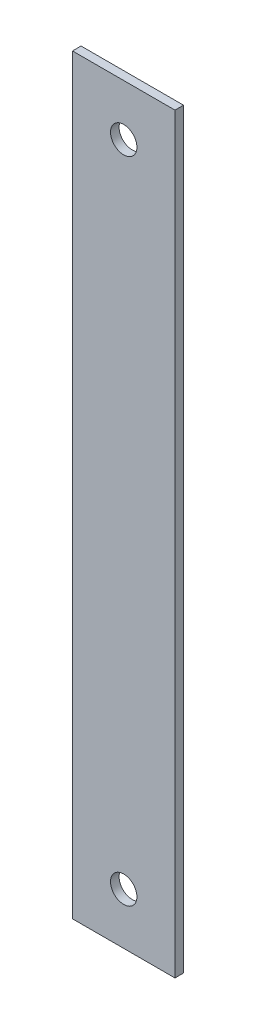
from build123d import *

# Parameters (mm, degrees)
SKETCH1_W                = 38.1
SKETCH1_H                = 279.4
BOSS_EXTRUDE1_DEPTH      = 3.175
W_0_386_DIAMETER_HOLE1_D = 9.8044


with BuildPart() as part:
    # Sketch1 → Boss-Extrude1 (new body)
    with BuildSketch(Plane.XY):
        with Locations((19.05, 139.7)):
            Rectangle(SKETCH1_W, SKETCH1_H)
    extrude(amount=BOSS_EXTRUDE1_DEPTH)

    # W (0.386) Diameter Hole1 (through all)
    with Locations(Plane.XY.offset(3.175)):
        with Locations((19.05, 260.35), (19.05, 19.05)):
            Hole(W_0_386_DIAMETER_HOLE1_D / 2)


solid = part.part
